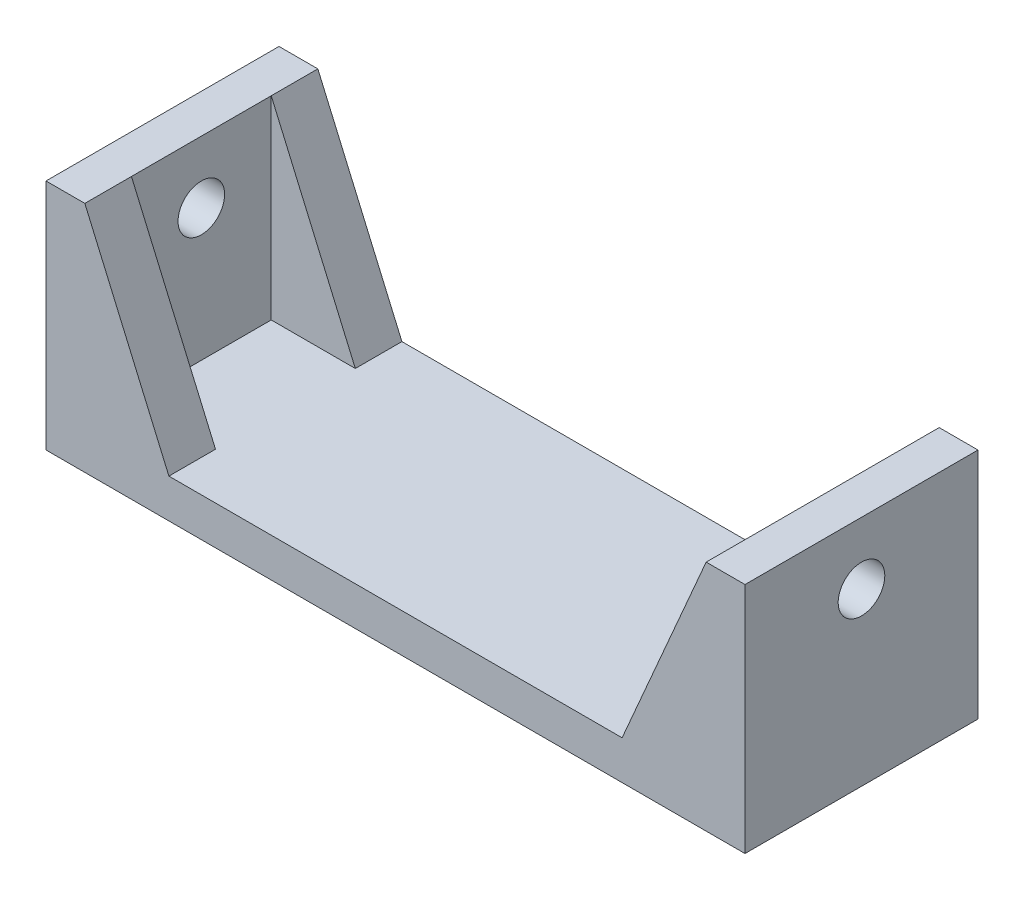
from build123d import *

# Parameters (mm, degrees)
SKETCH1_W               = 90
SKETCH1_H               = 30
BOSS_EXTRUDE1_DEPTH     = 30
SHELL1_T                = -5
CUT_EXTRUDE1_DEPTH      = 100.498743711
CUT_EXTRUDE1_DEPTH_BACK = 100.498743711
SKETCH2_R               = 3
RIB1_REACH              = 101.499
SKETCH4_WALL_W          = 228.240511764
SKETCH4_WALL_H          = 6
MIRROR2_COPY_1_REACH    = 101.499
MIRROR2_COPY_1_SKETCH_W = 228.240511764
MIRROR2_COPY_1_SKETCH_H = 6


with BuildPart() as part:
    # Sketch1 → Boss-Extrude1 (new body)
    with BuildSketch(Plane(origin=(0, 0, 0), x_dir=(1, 0, 0), z_dir=(0, 1, 0))):
        with Locations((45, 15)):
            Rectangle(SKETCH1_W, SKETCH1_H)
    extrude(amount=BOSS_EXTRUDE1_DEPTH)

    # Shell1
    shell1_openings = [part.faces().sort_by_distance(p)[0] for p in [
        (45, 30, -15),
        (45, 15, -30),
        (45, 15, 0),
    ]]
    offset(amount=SHELL1_T, openings=shell1_openings, kind=Kind.INTERSECTION)

    # Sketch2 → Cut-Extrude1 (cut, two sides: drawn at the far end of the back side and taken through both)
    with BuildSketch(Plane(origin=(90, 0, 0), x_dir=(0, 0, -1), z_dir=(1, 0, 0)).offset(-CUT_EXTRUDE1_DEPTH_BACK)):
        with Locations((15, 22)):
            Circle(SKETCH2_R)
    extrude(amount=CUT_EXTRUDE1_DEPTH + CUT_EXTRUDE1_DEPTH_BACK, mode=Mode.SUBTRACT)

    # Sketch4 wall → Rib1 (add, up to next)
    with BuildSketch(Plane(origin=(10.412540423, 17.5, 0), x_dir=(0.397352390435, -0.917666103665, 0), z_dir=(0.917666103665, 0.397352390435, 0)), mode=Mode.PRIVATE) as rib1_sk1:
        with Locations((0, 3)):
            Rectangle(SKETCH4_WALL_W, SKETCH4_WALL_H)
    rib1_tool1 = extrude(rib1_sk1.sketch, amount=-RIB1_REACH, mode=Mode.PRIVATE) - part.part
    rib1 = rib1_tool1.solids().sort_by_distance((10.412540423, 17.5, 0))[0]
    add(rib1)

    # Mirror1: Rib1 across plane
    add(rib1.mirror(Plane(origin=(45, 0, 0), x_dir=(0, 0, 1), z_dir=(1, 0, 0))))

    # Mirror2: Rib1 across plane
    add(rib1.mirror(Plane.XY.offset(-15)))

    # Mirror2 copy 1 sketch → Mirror2 copy 1 (add, up to next)
    with BuildSketch(Plane(origin=(79.587459577, 17.5, -30), x_dir=(-0.397352390435, -0.917666103665, 0), z_dir=(-0.917666103665, 0.397352390435, 0)), mode=Mode.PRIVATE) as mirror2_copy_1_sk1:
        with Locations((0, 3)):
            Rectangle(MIRROR2_COPY_1_SKETCH_W, MIRROR2_COPY_1_SKETCH_H)
    mirror2_copy_1_tool1 = extrude(mirror2_copy_1_sk1.sketch, amount=-MIRROR2_COPY_1_REACH, mode=Mode.PRIVATE) - part.part
    add(mirror2_copy_1_tool1.solids().sort_by_distance((79.587459577, 17.5, -30))[0])


solid = part.part
